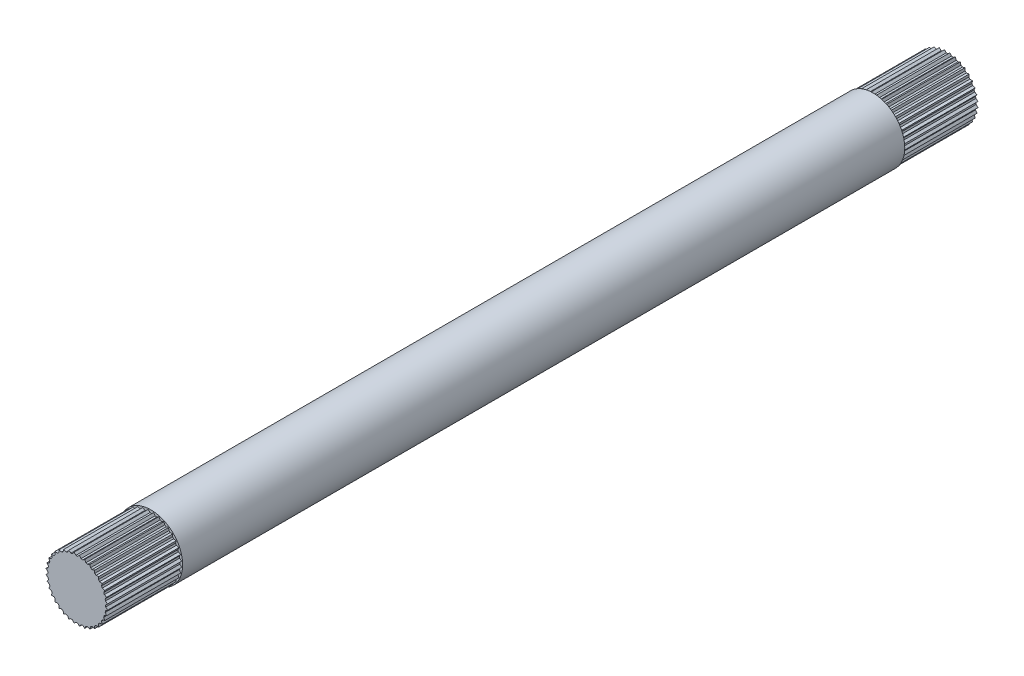
from build123d import *

# Parameters (mm, degrees)
SKETCH5_W           = 1.587499994
SKETCH5_H           = 261.0485
CUT_EXTRUDE7_START  = 283.21
SKETCH8_R           = 12.7
CUT_EXTRUDE7_DEPTH  = 22.225
SKETCH10_R          = 7.9375
BOSS_EXTRUDE1_DEPTH = 235.6485
SKETCH8_2_R         = 12.7
CUT_EXTRUDE8_DEPTH  = 44.4119


with BuildPart() as part:
    # Sketch5 → Revolve2 (revolve)
    with BuildSketch(Plane(origin=(0, 0, 0), x_dir=(1, 0, 0), z_dir=(0, 1, 0)), mode=Mode.PRIVATE) as revolve2_sk:
        with Locations((8.731249997, -152.68575)):
            Rectangle(SKETCH5_W, SKETCH5_H)
    revolve(revolve2_sk.sketch.rotate(Axis((0, 0, 0), (0, 0, 1)), 180), axis=Axis((0, 0, 0), (0, 0, 1)))

    # Sketch8 → Cut-Extrude7 (cut)
    with BuildSketch(Plane.XY.offset(CUT_EXTRUDE7_START)):
        Circle(SKETCH8_R)
        Polygon((9.235721046, -0.808020891), (8.681700155, -0.254), (8.681700155, 0.254), (9.235721046, 0.808020891), (8.593912259, 1.257420242), (8.505698985, 1.75770258), (8.955098336, 2.399511367), (8.245002688, 2.730634406), (8.071256455, 3.207998257), (8.402379494, 3.918093905), (7.645572882, 4.120879625), (7.391572882, 4.56082053), (7.594358603, 5.317627141), (6.813836213, 5.385914002), (6.487300108, 5.775064579), (6.555586968, 6.555586968), (5.775064579, 6.487300108), (5.385914002, 6.813836213), (5.317627141, 7.594358603), (4.56082053, 7.391572882), (4.120879625, 7.645572882), (3.918093905, 8.402379494), (3.207998257, 8.071256455), (2.730634406, 8.245002688), (2.399511367, 8.955098336), (1.75770258, 8.505698985), (1.257420242, 8.593912259), (0.808020891, 9.235721046), (0.254, 8.681700155), (-0.254, 8.681700155), (-0.808020891, 9.235721046), (-1.257420242, 8.593912259), (-1.75770258, 8.505698985), (-2.399511367, 8.955098336), (-2.730634406, 8.245002688), (-3.207998257, 8.071256455), (-3.918093905, 8.402379494), (-4.120879625, 7.645572882), (-4.56082053, 7.391572882), (-5.317627141, 7.594358603), (-5.385914002, 6.813836213), (-5.775064579, 6.487300108), (-6.555586968, 6.555586968), (-6.487300108, 5.775064579), (-6.813836213, 5.385914002), (-7.594358603, 5.317627141), (-7.391572882, 4.56082053), (-7.645572882, 4.120879625), (-8.402379494, 3.918093905), (-8.071256455, 3.207998257), (-8.245002688, 2.730634406), (-8.955098336, 2.399511367), (-8.505698985, 1.75770258), (-8.593912259, 1.257420242), (-9.235721046, 0.808020891), (-8.681700155, 0.254), (-8.681700155, -0.254), (-9.235721046, -0.808020891), (-8.593912259, -1.257420242), (-8.505698985, -1.75770258), (-8.955098336, -2.399511367), (-8.245002688, -2.730634406), (-8.071256455, -3.207998257), (-8.402379494, -3.918093905), (-7.645572882, -4.120879625), (-7.391572882, -4.56082053), (-7.594358603, -5.317627141), (-6.813836213, -5.385914002), (-6.487300108, -5.775064579), (-6.555586968, -6.555586968), (-5.775064579, -6.487300108), (-5.385914002, -6.813836213), (-5.317627141, -7.594358603), (-4.56082053, -7.391572882), (-4.120879625, -7.645572882), (-3.918093905, -8.402379494), (-3.207998257, -8.071256455), (-2.730634406, -8.245002688), (-2.399511367, -8.955098336), (-1.75770258, -8.505698985), (-1.257420242, -8.593912259), (-0.808020891, -9.235721046), (-0.254, -8.681700155), (0.254, -8.681700155), (0.808020891, -9.235721046), (1.257420242, -8.593912259), (1.75770258, -8.505698985), (2.399511367, -8.955098336), (2.730634406, -8.245002688), (3.207998257, -8.071256455), (3.918093905, -8.402379494), (4.120879625, -7.645572882), (4.56082053, -7.391572882), (5.317627141, -7.594358603), (5.385914002, -6.813836213), (5.775064579, -6.487300108), (6.555586968, -6.555586968), (6.487300108, -5.775064579), (6.813836213, -5.385914002), (7.594358603, -5.317627141), (7.391572882, -4.56082053), (7.645572882, -4.120879625), (8.402379494, -3.918093905), (8.071256455, -3.207998257), (8.245002688, -2.730634406), (8.955098336, -2.399511367), (8.505698985, -1.75770258), (8.593912259, -1.257420242), align=None, mode=Mode.SUBTRACT)
    extrude(amount=-CUT_EXTRUDE7_DEPTH, mode=Mode.SUBTRACT)

    # Sketch10 → Boss-Extrude1 (add)
    with BuildSketch(Plane(origin=(0, 0, 47.5615), x_dir=(-1, 0, 0), z_dir=(0, 0, -1))):
        Circle(SKETCH10_R)
    extrude(amount=-BOSS_EXTRUDE1_DEPTH)

    # Sketch8<2> → Cut-Extrude8 (cut)
    with BuildSketch(Plane.XY):
        Circle(SKETCH8_2_R)
        Polygon((9.235721046, -0.808020891), (8.681700155, -0.254), (8.681700155, 0.254), (9.235721046, 0.808020891), (8.593912259, 1.257420242), (8.505698985, 1.75770258), (8.955098336, 2.399511367), (8.245002688, 2.730634406), (8.071256455, 3.207998257), (8.402379494, 3.918093905), (7.645572882, 4.120879625), (7.391572882, 4.56082053), (7.594358603, 5.317627141), (6.813836213, 5.385914002), (6.487300108, 5.775064579), (6.555586968, 6.555586968), (5.775064579, 6.487300108), (5.385914002, 6.813836213), (5.317627141, 7.594358603), (4.56082053, 7.391572882), (4.120879625, 7.645572882), (3.918093905, 8.402379494), (3.207998257, 8.071256455), (2.730634406, 8.245002688), (2.399511367, 8.955098336), (1.75770258, 8.505698985), (1.257420242, 8.593912259), (0.808020891, 9.235721046), (0.254, 8.681700155), (-0.254, 8.681700155), (-0.808020891, 9.235721046), (-1.257420242, 8.593912259), (-1.75770258, 8.505698985), (-2.399511367, 8.955098336), (-2.730634406, 8.245002688), (-3.207998257, 8.071256455), (-3.918093905, 8.402379494), (-4.120879625, 7.645572882), (-4.56082053, 7.391572882), (-5.317627141, 7.594358603), (-5.385914002, 6.813836213), (-5.775064579, 6.487300108), (-6.555586968, 6.555586968), (-6.487300108, 5.775064579), (-6.813836213, 5.385914002), (-7.594358603, 5.317627141), (-7.391572882, 4.56082053), (-7.645572882, 4.120879625), (-8.402379494, 3.918093905), (-8.071256455, 3.207998257), (-8.245002688, 2.730634406), (-8.955098336, 2.399511367), (-8.505698985, 1.75770258), (-8.593912259, 1.257420242), (-9.235721046, 0.808020891), (-8.681700155, 0.254), (-8.681700155, -0.254), (-9.235721046, -0.808020891), (-8.593912259, -1.257420242), (-8.505698985, -1.75770258), (-8.955098336, -2.399511367), (-8.245002688, -2.730634406), (-8.071256455, -3.207998257), (-8.402379494, -3.918093905), (-7.645572882, -4.120879625), (-7.391572882, -4.56082053), (-7.594358603, -5.317627141), (-6.813836213, -5.385914002), (-6.487300108, -5.775064579), (-6.555586968, -6.555586968), (-5.775064579, -6.487300108), (-5.385914002, -6.813836213), (-5.317627141, -7.594358603), (-4.56082053, -7.391572882), (-4.120879625, -7.645572882), (-3.918093905, -8.402379494), (-3.207998257, -8.071256455), (-2.730634406, -8.245002688), (-2.399511367, -8.955098336), (-1.75770258, -8.505698985), (-1.257420242, -8.593912259), (-0.808020891, -9.235721046), (-0.254, -8.681700155), (0.254, -8.681700155), (0.808020891, -9.235721046), (1.257420242, -8.593912259), (1.75770258, -8.505698985), (2.399511367, -8.955098336), (2.730634406, -8.245002688), (3.207998257, -8.071256455), (3.918093905, -8.402379494), (4.120879625, -7.645572882), (4.56082053, -7.391572882), (5.317627141, -7.594358603), (5.385914002, -6.813836213), (5.775064579, -6.487300108), (6.555586968, -6.555586968), (6.487300108, -5.775064579), (6.813836213, -5.385914002), (7.594358603, -5.317627141), (7.391572882, -4.56082053), (7.645572882, -4.120879625), (8.402379494, -3.918093905), (8.071256455, -3.207998257), (8.245002688, -2.730634406), (8.955098336, -2.399511367), (8.505698985, -1.75770258), (8.593912259, -1.257420242), align=None, mode=Mode.SUBTRACT)
    extrude(amount=CUT_EXTRUDE8_DEPTH, mode=Mode.SUBTRACT)


solid = part.part
